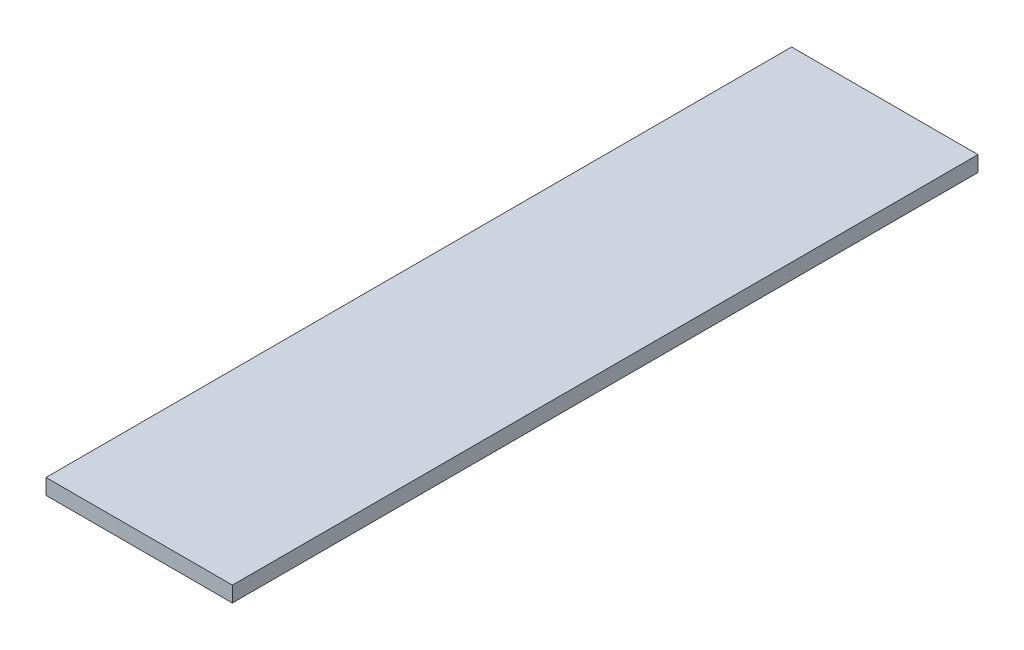
from build123d import *

# Parameters (mm, degrees)
SKETCH1_W           = 76.2
SKETCH1_H           = 6.35
BOSS_EXTRUDE1_DEPTH = 304.8


with BuildPart() as part:
    # Sketch1 → Boss-Extrude1 (new body)
    with BuildSketch(Plane.XY):
        with Locations((0, 41.275)):
            Rectangle(SKETCH1_W, SKETCH1_H)
    extrude(amount=BOSS_EXTRUDE1_DEPTH)


solid = part.part
